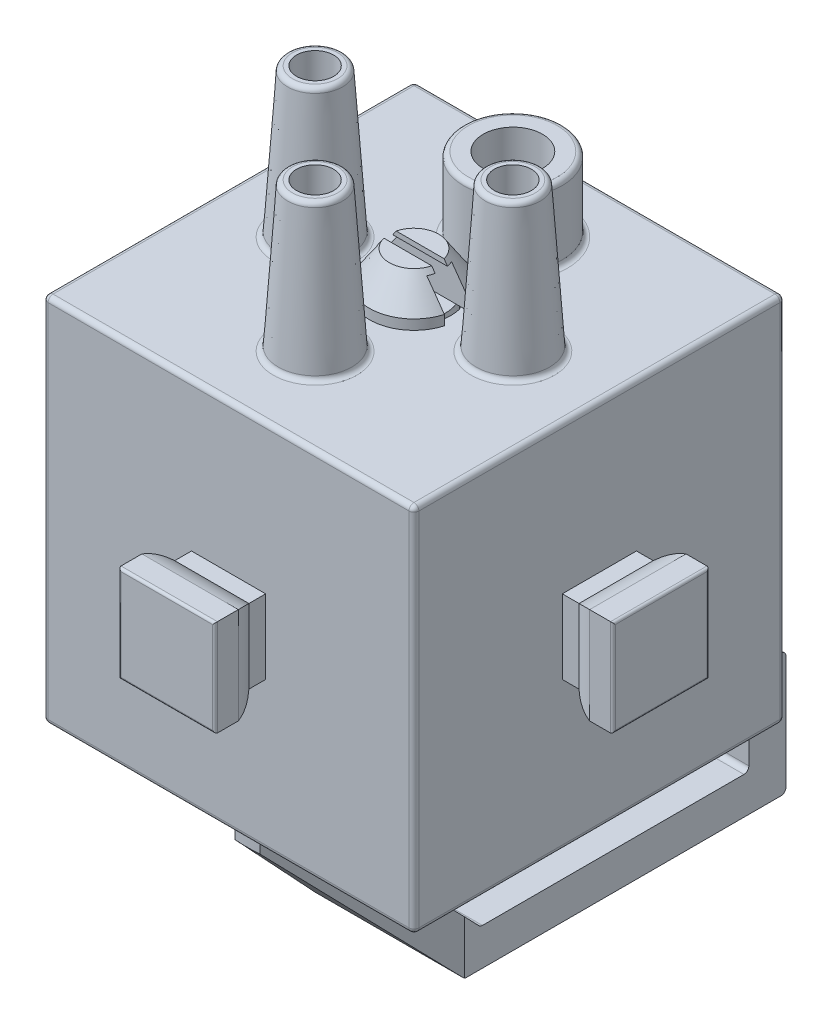
from build123d import *
from build123d.topology import SkipClean

# Parameters (mm, degrees)
SKETCH_1_W               = 15
SKETCH_1_H               = 15
EXTRUDE_1_DEPTH          = 15
EXTRUDE_2_DEPTH          = 15
CUT_EXTRUDE_2_DEPTH      = 15
PATTERN_CIRCULAR_1_COUNT = 4
SKETCH_7_R               = 7
CUT_EXTRUDE_3_DEPTH      = 5
SKETCH_8_R               = 6.75
EXTRUDE_3_DEPTH          = 5
EXTRUDE_4_DEPTH          = 2
EXTRUDE_5_DEPTH          = 5
CUT_EXTRUDE_4_DEPTH      = 24.219018492
CUT_EXTRUDE_5_DEPTH      = 2
SKETCH_14_R              = 1.1
SKETCH_13_R              = 1.5
SKETCH_15_R              = 0.75
CUT_EXTRUDE_6_DEPTH      = 6
PATTERN_CIRCULAR_3_COUNT = 3
PATTERN_CIRCULAR_3_ANGLE = 180
SKETCH_16_R              = 2
SKETCH_16_R_2            = 1.2
EXTRUDE_6_DEPTH          = 3
FILLET_1_R               = 0.2
FILLET_2_R               = 0.2
FILLET_5_R               = 0.2
FILLET_7_R               = 0.2
FILLET_8_R               = 0.1
SKETCH_17_R              = 1.5
CUT_EXTRUDE_7_DEPTH      = 10
SKETCH_18_R              = 1.3
EXTRUDE_7_DEPTH          = 10
SKETCH_20_R              = 1.8
EXTRUDE_8_DEPTH          = 0.4
SKETCH_23_R              = 1.8
SKETCH_22_R              = 1
CUT_EXTRUDE_8_DEPTH      = 2
CUT_EXTRUDE_8_DEPTH_BACK = 2


with BuildPart() as part:
    # 草图1 → 凸台-拉伸1 (new body)
    with BuildSketch(Plane(origin=(0, 0, 0), x_dir=(1, 0, 0), z_dir=(0, 1, 0))):
        Rectangle(SKETCH_1_W, SKETCH_1_H)
    extrude(amount=EXTRUDE_1_DEPTH)

    # 草图2 → 凸台-拉伸2 (add)
    with BuildSketch(Plane.XZ):
        with BuildLine():
            Line((1.95, 10), (-1.95, 10))
            Line((-1.95, 10), (-1.95, 9.055590279))
            ThreePointArc((-1.95, 9.055590279), (-1.780042303, 8.588161527), (-1.5, 8.177124344))
            Line((-1.5, 8.177124344), (-1.5, 7.5))
            Line((-1.5, 7.5), (1.5, 7.5))
            Line((1.5, 7.5), (1.5, 8.177124344))
            ThreePointArc((1.5, 8.177124344), (1.780042303, 8.588161527), (1.95, 9.055590279))
            Line((1.95, 9.055590279), (1.95, 10))
        make_face()
    extrude_2 = extrude(amount=-EXTRUDE_2_DEPTH)

    # 草图5 → 切除-拉伸2 (cut)
    with BuildSketch(Plane(origin=(7.5, 0, 0), x_dir=(0, 0, -1), z_dir=(1, 0, 0))):
        with BuildLine():
            Line((-7.5, 0), (-7.5, 6))
            Line((-7.5, 6), (-8.177124344, 6))
            ThreePointArc((-8.177124344, 6), (-8.588161527, 5.719957697), (-9.055590279, 5.55))
            Line((-9.055590279, 5.55), (-10, 5.55))
            Line((-10, 5.55), (-10, 0))
            Line((-10, 0), (-7.5, 0))
        make_face()
        with BuildLine():
            Line((-10, 9.45), (-9.055590279, 9.45))
            ThreePointArc((-9.055590279, 9.45), (-8.588161527, 9.280042303), (-8.177124344, 9))
            Line((-8.177124344, 9), (-7.5, 9))
            Line((-7.5, 9), (-7.5, 15))
            Line((-7.5, 15), (-10, 15))
            Line((-10, 15), (-10, 9.45))
        make_face()
    cut_extrude_2 = extrude(amount=-CUT_EXTRUDE_2_DEPTH, mode=Mode.SUBTRACT)

    # 阵列(圆周)1: 凸台-拉伸2, 切除-拉伸2 ×4 about axis
    pattern_circular_1_axis = Axis((0, 0, 0), (0, 1, 0))
    add([extrude_2.rotate(pattern_circular_1_axis, i * 360 / PATTERN_CIRCULAR_1_COUNT) for i in range(1, PATTERN_CIRCULAR_1_COUNT)])
    add([cut_extrude_2.rotate(pattern_circular_1_axis, i * 360 / PATTERN_CIRCULAR_1_COUNT) for i in range(1, PATTERN_CIRCULAR_1_COUNT)], mode=Mode.SUBTRACT)

    # 草图7 → 切除-拉伸3 (cut)
    with BuildSketch(Plane.XZ):
        with Locations(Location((0, 0, 0), (0, 0, 270))):
            Circle(SKETCH_7_R)
    extrude(amount=-CUT_EXTRUDE_3_DEPTH, mode=Mode.SUBTRACT)

    # 草图8 → 凸台-拉伸3 (add)
    with BuildSketch(Plane.XZ.offset(-5)):
        with Locations(Location((0, 0, 0), (0, 0, 270))):
            Circle(SKETCH_8_R)
    extrude(amount=EXTRUDE_3_DEPTH)

    # 草图9 → 凸台-拉伸4 (add)
    with BuildSketch(Plane.XZ):
        with BuildLine():
            Line((3, -6.046693311), (3, 0.953306689))
            Line((3, 0.953306689), (0.5, 6.731456009))
            ThreePointArc((0.5, 6.731456009), (0, 6.75), (-0.5, 6.731456009))
            Line((-0.5, 6.731456009), (-3, 0.953306689))
            Line((-3, 0.953306689), (-3, -6.046693311))
            ThreePointArc((-3, -6.046693311), (0, -6.75), (3, -6.046693311))
        make_face()
    extrude(amount=EXTRUDE_4_DEPTH)

    # 草图10 → 凸台-拉伸5 (add)
    with SkipClean():  # the faces are left unmerged after this step: merging them gives an invalid solid
        with BuildSketch(Plane.XZ.offset(2)):
            with BuildLine():
                Line((3, -12.046693311), (-3, -12.046693311))
                Line((-3, -12.046693311), (-3, -6.046693311))
                Line((-3, -6.046693311), (-3, 0.953306689))
                Line((-3, 0.953306689), (-0.5, 6.731456009))
                ThreePointArc((-0.5, 6.731456009), (0, 6.75), (0.5, 6.731456009))
                Line((0.5, 6.731456009), (3, 0.953306689))
                Line((3, 0.953306689), (3, -6.046693311))
                Line((3, -6.046693311), (3, -12.046693311))
            make_face()
        extrude(amount=EXTRUDE_5_DEPTH)

    # 草图11 → 切除-拉伸4 (cut, through all)
    with BuildSketch(Plane(origin=(3, 0, 0), x_dir=(0, 0, -1), z_dir=(1, 0, 0))):
        Polygon((-6.731456009, -1), (-0.953306689, -7), (-6.731456009, -7), (-7.968302224, -7), (-7.968302224, -1), align=None)
    extrude(amount=-CUT_EXTRUDE_4_DEPTH, mode=Mode.SUBTRACT)

    # 草图12 → 切除-拉伸5 (cut)
    with BuildSketch(Plane.ZY.offset(3)):
        Polygon((-6.046693311, -3.5), (-10.546693311, -3.5), (-10.546693311, -5.5), (0.315372387, -5.5), (2.24142216, -3.5), align=None)
        Polygon((-5.046693311, -0.5), (-5.046693311, -2), (3.68595949, -2), (5.13049682, -0.5), (0.953306689, -0.5), align=None)
    cut_extrude_5 = extrude(amount=-CUT_EXTRUDE_5_DEPTH, mode=Mode.SUBTRACT)

    # 镜向1: 切除-拉伸5 across plane
    add(cut_extrude_5.mirror(Plane(origin=(0, 0, 0), x_dir=(0, 0, 1), z_dir=(1, 0, 0))), mode=Mode.SUBTRACT)

    # 草图14 → 放样2 section 0
    with BuildSketch(Plane(origin=(0, 21, 0), x_dir=(1, 0, 0), z_dir=(0, 1, 0))):
        with Locations((4, 0)):
            Circle(SKETCH_14_R)
    # 草图13 → 放样2 section 1
    with BuildSketch(Plane(origin=(0, 15, 0), x_dir=(1, 0, 0), z_dir=(0, 1, 0))):
        with Locations((4, 0)):
            Circle(SKETCH_13_R)
    loft_2 = loft()

    # 草图15 → 切除-拉伸6 (cut)
    with BuildSketch(Plane(origin=(0, 21, 0), x_dir=(1, 0, 0), z_dir=(0, 1, 0))):
        with Locations(Location((4, 0, 0), (0, 0, 270))):
            Circle(SKETCH_15_R)
    cut_extrude_6 = extrude(amount=-CUT_EXTRUDE_6_DEPTH, mode=Mode.SUBTRACT)

    # 阵列(圆周)3: 放样2, 切除-拉伸6 ×3 about axis
    pattern_circular_3_axis = Axis((0, 0, 0), (0, -1, 0))
    add([loft_2.rotate(pattern_circular_3_axis, i * PATTERN_CIRCULAR_3_ANGLE / (PATTERN_CIRCULAR_3_COUNT - 1)) for i in range(1, PATTERN_CIRCULAR_3_COUNT)])
    add([cut_extrude_6.rotate(pattern_circular_3_axis, i * PATTERN_CIRCULAR_3_ANGLE / (PATTERN_CIRCULAR_3_COUNT - 1)) for i in range(1, PATTERN_CIRCULAR_3_COUNT)], mode=Mode.SUBTRACT)

    # 草图16 → 凸台-拉伸6 (add)
    with BuildSketch(Plane(origin=(0, 15, 0), x_dir=(1, 0, 0), z_dir=(0, 1, 0))):
        with Locations(Location((0, 4, 0), (0, 0, 90))):
            Circle(SKETCH_16_R)
        with Locations(Location((0, 4, 0), (0, 0, 270))):
            Circle(SKETCH_16_R_2, mode=Mode.SUBTRACT)
    extrude(amount=EXTRUDE_6_DEPTH)

    # 圆角1
    fillet_1_edges = [part.edges().sort_by_distance(p)[0] for p in [
        (0, 15, 7.5),
        (7.5, 15, 0),
        (0, 15, -7.5),
        (7.5, 0, 0),
        (0, 0, 7.5),
        (-7.5, 0, 0),
        (0, 0, -7.5),
        (-7.5, 15, 0),
        (7.5, 7.5, -7.5),
        (7.5, 7.5, 7.5),
        (-7.5, 7.5, 7.5),
        (-7.5, 7.5, -7.5),
    ]]
    fillet(fillet_1_edges, radius=FILLET_1_R)

    # 圆角2
    fillet_2_edges = [part.edges().sort_by_distance(p)[0] for p in [
        (-1.721339091, -3.5, 2.24142216),
        (-2, -3.5, -10.546693311),
        (-2, -5.5, 0.315372387),
        (-2, -5.5, -10.546693311),
        (-1.096339091, -0.5, 5.13049682),
        (-1.408839091, -2, 3.68595949),
        (-2, -0.5, -5.046693311),
        (-2, -2, -5.046693311),
        (1.721339091, -3.5, 2.24142216),
        (2, -5.5, 0.315372387),
        (2, -3.5, -10.546693311),
        (2, -5.5, -10.546693311),
        (2, -2, -5.046693311),
        (1.408839091, -2, 3.68595949),
        (1.096339091, -0.5, 5.13049682),
        (2, -0.5, -5.046693311),
    ]]
    fillet(fillet_2_edges, radius=FILLET_2_R)

    # 圆角5
    fillet_5_edges = [part.edges().sort_by_distance(p)[0] for p in [
        (0, -7, 0.953306689),
        (0, -7, -12.046693311),
        (0, -2, -12.046693311),
    ]]
    fillet(fillet_5_edges, radius=FILLET_5_R)

    # 圆角7
    fillet_7_edges = [part.edges().sort_by_distance(p)[0] for p in [
        (2.9, 21, 0),
        (2.5, 15, 0),
        (0, 21, 2.9),
        (0, 15, 2.5),
        (-2.9, 21, 0),
        (-2.5, 15, 0),
        (0, 15, -2),
        (0, 18, -2),
    ]]
    fillet(fillet_7_edges, radius=FILLET_7_R)

    # 圆角8
    fillet_8_edges = [part.edges().sort_by_distance(p)[0] for p in [
        (10, 7.5, -1.95),
        (10, 7.5, 1.95),
        (10, 9.45, 0),
        (10, 5.55, 0),
        (-1.95, 7.5, -10),
        (1.95, 7.5, -10),
        (0, 9.45, -10),
        (0, 5.55, -10),
        (-10, 7.5, 1.95),
        (-10, 7.5, -1.95),
        (-10, 9.45, 0),
        (-10, 5.55, 0),
        (1.95, 7.5, 10),
        (-1.95, 7.5, 10),
        (0, 9.45, 10),
        (0, 5.55, 10),
    ]]
    fillet(fillet_8_edges, radius=FILLET_8_R)

    # 草图17 → 切除-拉伸7 (cut)
    with BuildSketch(Plane(origin=(0, 15, 0), x_dir=(1, 0, 0), z_dir=(0, 1, 0))):
        with Locations(Location((0, 0, 0), (0, 0, 270))):
            Circle(SKETCH_17_R)
    extrude(amount=-CUT_EXTRUDE_7_DEPTH, mode=Mode.SUBTRACT)

    # 草图18 → 凸台-拉伸7 (add)
    with BuildSketch(Plane(origin=(0, 5, 0), x_dir=(1, 0, 0), z_dir=(0, 1, 0))):
        with Locations(Location((0, 0, 0), (0, 0, 270))):
            Circle(SKETCH_18_R)
    extrude(amount=EXTRUDE_7_DEPTH)

    # 草图20 → 凸台-拉伸8 (add)
    with BuildSketch(Plane(origin=(0, 15, 0), x_dir=(1, 0, 0), z_dir=(0, 1, 0))):
        with Locations(Location((0, 0, 0), (0, 0, 89.999552097))):
            Circle(SKETCH_20_R)
    extrude(amount=EXTRUDE_8_DEPTH)

    # 草图23 → 放样4 section 0
    with BuildSketch(Plane(origin=(0, 15.4, 0), x_dir=(1, 0, 0), z_dir=(0, 1, 0))):
        Circle(SKETCH_23_R)
    # 草图22 → 放样4 section 1
    with BuildSketch(Plane(origin=(0, 16.6, 0), x_dir=(1, 0, 0), z_dir=(0, 1, 0))):
        Circle(SKETCH_22_R)
    loft()

    # 草图24 → 切除-拉伸8 (cut, two sides: drawn at the far end of the back side and taken through both)
    with BuildSketch(Plane(origin=(0, 0, 0), x_dir=(0, 0, -1), z_dir=(1, 0, 0)).offset(-CUT_EXTRUDE_8_DEPTH_BACK)):
        Polygon((-0.5, 15), (-0.5, 16.4), (-0.25, 16.4), (-0.25, 16.8), (0.25, 16.8), (0.25, 16.4), (0.5, 16.4), (0.5, 15), align=None)
    extrude(amount=CUT_EXTRUDE_8_DEPTH + CUT_EXTRUDE_8_DEPTH_BACK, mode=Mode.SUBTRACT)


solid = part.part
